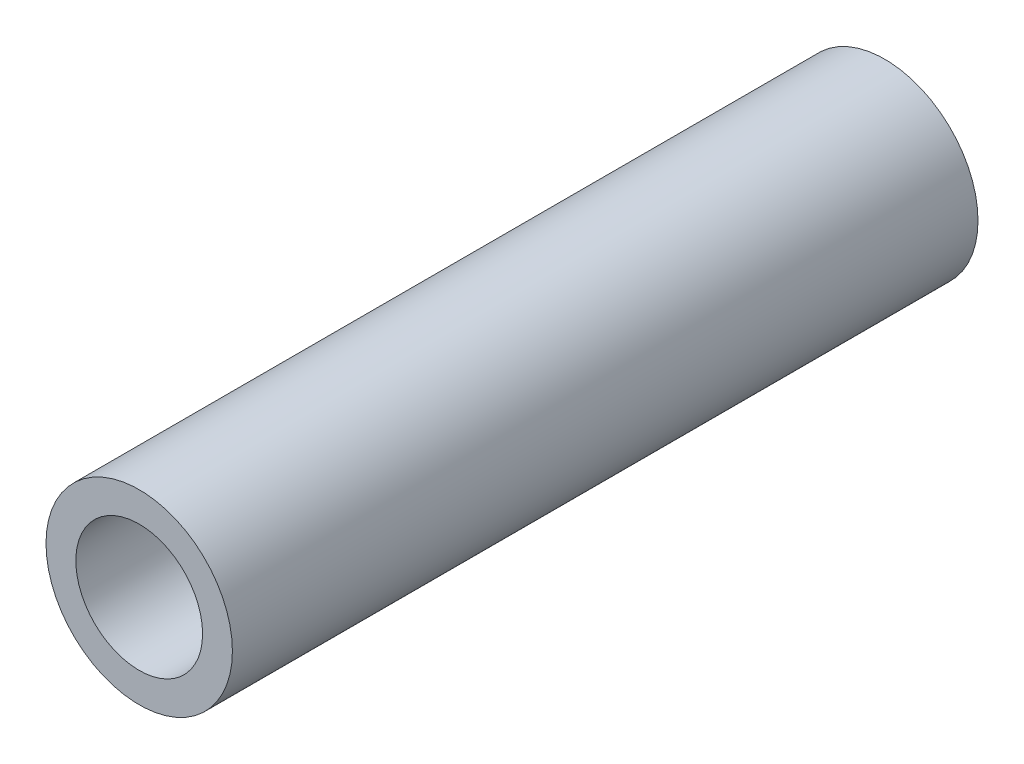
from build123d import *

# Parameters (mm, degrees)
SKETCH1_R               = 2.5
BOSS_EXTRUDE1_DEPTH     = 20
CUT_EXTRUDE1_DEPTH      = 21.310096012
CUT_EXTRUDE1_DEPTH_BACK = 21.310096012
SKETCH2_R               = 1.7


with BuildPart() as part:
    # Sketch1 → Boss-Extrude1 (new body)
    with BuildSketch(Plane(origin=(0, 0, 0), x_dir=(0, 1, 0), z_dir=(0, 0, 1))):
        with Locations(Location((0, 0, 0), (0, 0, 270))):
            Circle(SKETCH1_R)
    extrude(amount=BOSS_EXTRUDE1_DEPTH)

    # Sketch2 → Cut-Extrude1 (cut, two sides: drawn at the far end of the back side and taken through both)
    with BuildSketch(Plane.XY.offset(20).offset(-CUT_EXTRUDE1_DEPTH_BACK)):
        Circle(SKETCH2_R)
    extrude(amount=CUT_EXTRUDE1_DEPTH + CUT_EXTRUDE1_DEPTH_BACK, mode=Mode.SUBTRACT)


solid = part.part
